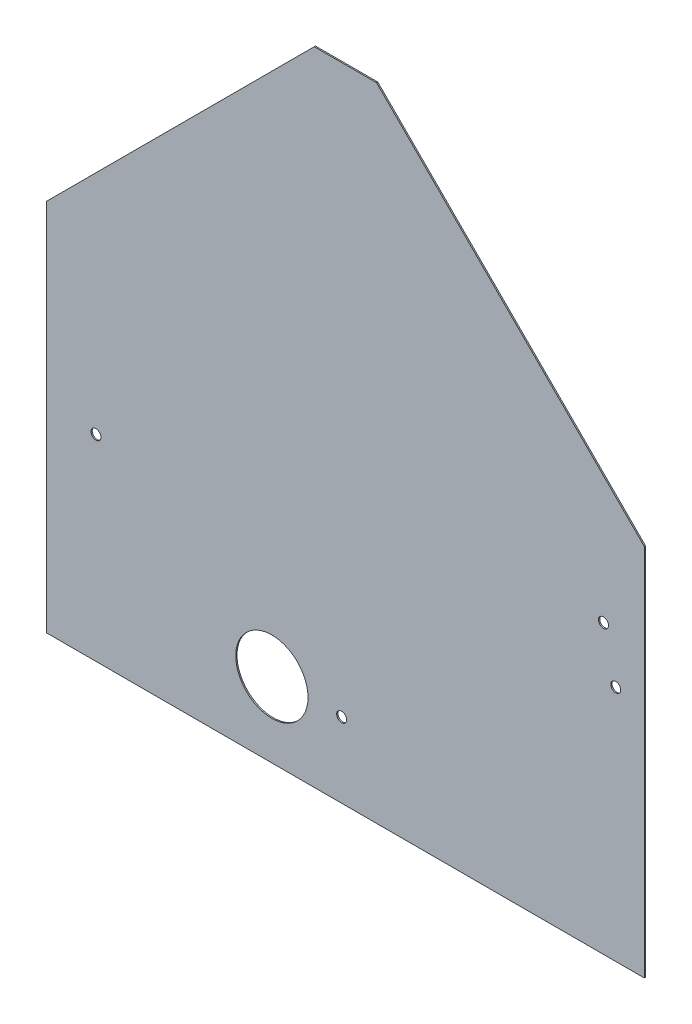
from build123d import *

# Parameters (mm, degrees)
ESQUISSE1_R        = 4
ESQUISSE1_R_2      = 29
BOSS_EXTRU_1_DEPTH = 1


with BuildPart() as part:
    # Esquisse1 → Boss.-Extru.1 (new body)
    with BuildSketch(Plane.XY):
        Polygon((-86.510331807, 327.172651118), (-86.510331807, 27.172651118), (393.489668193, 27.172651118), (393.489668193, 327.172651118), (178.489668193, 542.172651118), (128.489668193, 542.172651118), align=None)
        with Locations((150.489668193, 87.172651118)):
            Circle(ESQUISSE1_R, mode=Mode.SUBTRACT)
        with Locations((360.721450059, 257.850781344)):
            Circle(ESQUISSE1_R, mode=Mode.SUBTRACT)
        with Locations((-46.760331807, 184.972737387)):
            Circle(ESQUISSE1_R, mode=Mode.SUBTRACT)
        with Locations((370.568932328, 217.872651118)):
            Circle(ESQUISSE1_R, mode=Mode.SUBTRACT)
        with Locations((94.489668193, 87.172651118)):
            Circle(ESQUISSE1_R_2, mode=Mode.SUBTRACT)
    extrude(amount=BOSS_EXTRU_1_DEPTH)


solid = part.part
